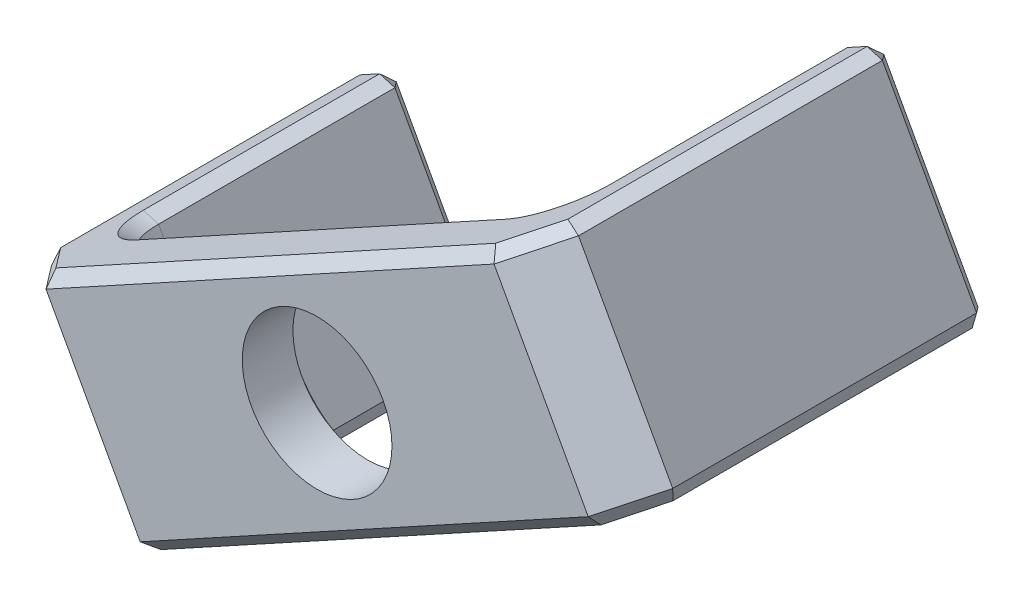
from build123d import *

# Parameters (mm, degrees)
SKETCH1_R           = 6.650000000000002
BOSS_EXTRUDE1_DEPTH = 6
BOSS_EXTRUDE2_DEPTH = 32
FILLET1_R           = 4
CHAMFER1_SIZE       = 4
CHAMFER2_SIZE       = 1
SKETCH3_R           = 8.699999999995331
CUT_EXTRUDE1_DEPTH  = 1.5


with BuildPart() as part:
    # Sketch1 → Boss-Extrude1 (new body)
    with BuildSketch(Plane.XY):
        Polygon((15.23657634098733, 19.422325849528544), (24.56734683192624, 2.4136009694730585), (24.12897763398666, 2.173117193933393), (-14.79820714304776, -19.1818420739889), (-15.236576340987371, -19.42232584952858), (-24.567346831926308, -2.4136009694729568), (-24.12897763398673, -2.173117193933293), (14.798207143047753, 19.181842073988882), align=None)
        Circle(SKETCH1_R, mode=Mode.SUBTRACT)
    extrude(amount=-BOSS_EXTRUDE1_DEPTH)

    # Sketch2 → Boss-Extrude2 (add)
    with BuildSketch(Plane.XY):
        Polygon((24.56734683192624, 2.4136009694730585), (15.23657634098733, 19.422325849528544), (18.743529924503946, 21.34619605384586), (28.07430041544286, 4.337471173790374), align=None)
        Polygon((-24.567346831926308, -2.4136009694729568), (-15.236576340987371, -19.42232584952858), (-18.743529924503996, -21.346196053845887), (-28.074300415442934, -4.337471173790264), align=None)
    extrude(amount=-BOSS_EXTRUDE2_DEPTH)

    # Fillet1
    fillet1_edges = [part.edges().sort_by_distance(p)[0] for p in [
        (19.901961586456785, 10.917963409500802, -6),
        (-19.90196158645684, -10.917963409500768, -6),
    ]]
    fillet(fillet1_edges, radius=FILLET1_R)

    # Chamfer1
    chamfer1_edges = [part.edges().sort_by_distance(p)[0] for p in [
        (23.408915169973405, 12.841833613818116, 0),
        (-23.408915169973465, -12.841833613818075, 0),
    ]]
    chamfer(chamfer1_edges, length=CHAMFER1_SIZE)

    # Chamfer2
    chamfer2_edges = [part.edges().sort_by_distance(p)[0] for p in [
        (26.32082362368455, 3.375536071631716, -32),
        (28.07430041544286, 4.337471173790374, -18),
        (24.56734683192624, 2.4136009694730585, -21),
        (19.901961586456785, 10.917963409500802, -32),
        (16.990053132745636, 20.384260951687203, -32),
        (15.23657634098733, 19.422325849528544, -21),
        (23.408915169973405, 12.841833613818116, -32),
        (18.743529924503946, 21.34619605384586, -18),
        (-26.32082362368462, -3.3755360716316103, -32),
        (-28.074300415442934, -4.337471173790264, -18),
        (-24.567346831926308, -2.4136009694729568, -21),
        (-19.90196158645684, -10.917963409500768, -32),
        (-16.990053132745683, -20.38426095168723, -32),
        (-15.236576340987371, -19.42232584952858, -21),
        (-23.408915169973465, -12.841833613818075, -32),
        (-18.743529924503996, -21.346196053845887, -18),
        (4.665385245469443, -8.504362440027757, -6),
        (-4.665385245469494, 8.504362440027792, -6),
        (-14.209413417681859, -18.858837312806703, -7.171572875253809),
        (-23.540183908620747, -1.8501124327511644, -7.171572875253809),
        (14.209413417681818, 18.85883731280668, -7.171572875253809),
        (23.54018390862069, 1.8501124327512626, -7.171572875253809),
        (-4.665385245469494, 8.504362440027798, 0),
        (4.66538524546943, -8.504362440027759, 0),
        (26.32082362368455, 3.375536071631717, -2.0000000000000004),
        (-16.99005313274572, -20.38426095168716, -2.0000000000000018),
        (16.990053132745686, 20.384260951687114, -1.9999999999999964),
        (-26.32082362368462, -3.3755360716316103, -2.000000000000001),
    ]]
    chamfer(chamfer2_edges, length=CHAMFER2_SIZE)

    # Sketch3 → Cut-Extrude1 (cut)
    with BuildSketch(Plane(origin=(0, 0, -6), x_dir=(-1, 0, 0), z_dir=(0, 0, -1))):
        Circle(SKETCH3_R)
    extrude(amount=-CUT_EXTRUDE1_DEPTH, mode=Mode.SUBTRACT)


solid = part.part
